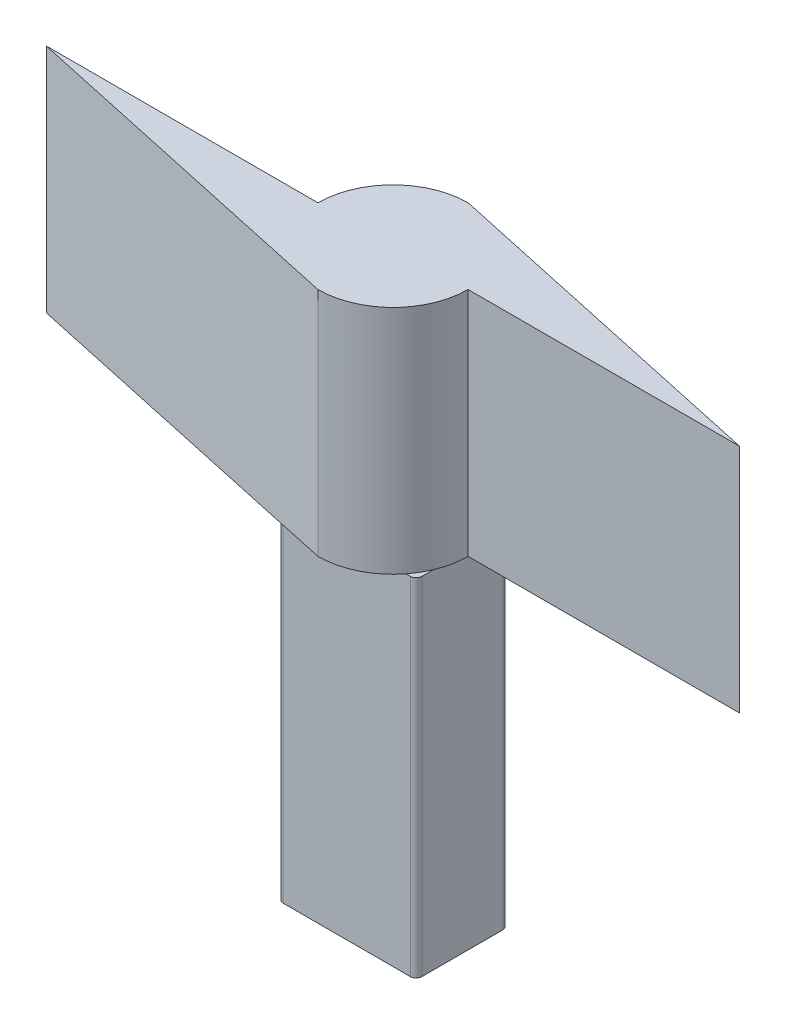
from build123d import *

# Parameters (mm, degrees)
CROQUIS1_W              = 5
CROQUIS1_H              = 3
SALIENTE_EXTRUIR1_DEPTH = 15
SALIENTE_EXTRUIR2_DEPTH = 10


with BuildPart() as part:
    # Croquis1 → Saliente-Extruir1 (new body)
    with BuildSketch(Plane(origin=(0, 0, 0), x_dir=(1, 0, 0), z_dir=(0, 1, 0))):
        with BuildLine():
            Line((-2.75, -2), (2.75, -2))
            ThreePointArc((2.75, -2), (2.926776695, -1.926776695), (3, -1.75))
            Line((3, -1.75), (3, 1.75))
            ThreePointArc((3, 1.75), (2.926776695, 1.926776695), (2.75, 2))
            Line((2.75, 2), (-2.75, 2))
            ThreePointArc((-2.75, 2), (-2.926776695, 1.926776695), (-3, 1.75))
            Line((-3, 1.75), (-3, -1.75))
            ThreePointArc((-3, -1.75), (-2.926776695, -1.926776695), (-2.75, -2))
        make_face()
        Rectangle(CROQUIS1_W, CROQUIS1_H, mode=Mode.SUBTRACT)
    extrude(amount=SALIENTE_EXTRUIR1_DEPTH)

    # Croquis2 → Saliente-Extruir2 (add)
    with BuildSketch(Plane(origin=(0, 15, 0), x_dir=(1, 0, 0), z_dir=(0, 1, 0))):
        with BuildLine():
            Line((-3.25, 0), (-15, 0))
            Line((-15, 0), (0, -3.25))
            ThreePointArc((0, -3.25), (2.298097039, -2.298097039), (3.25, 0))
            Line((3.25, 0), (15, 0))
            Line((15, 0), (0, 3.25))
            ThreePointArc((0, 3.25), (-2.298097039, 2.298097039), (-3.25, 0))
        make_face()
    extrude(amount=SALIENTE_EXTRUIR2_DEPTH)


solid = part.part
